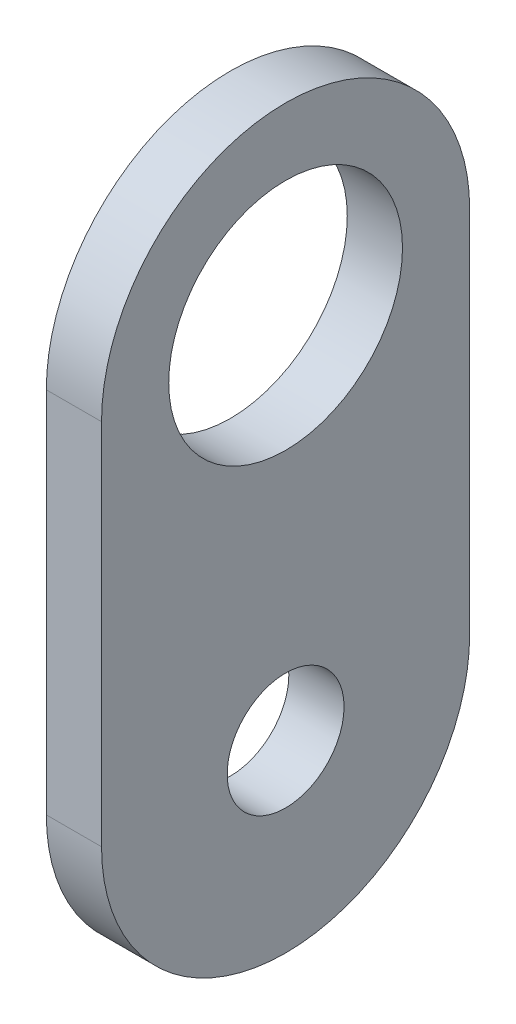
from build123d import *

# Parameters (mm, degrees)
SKETCH3_W           = 20
SKETCH3_H           = 40
BOSS_EXTRUDE1_DEPTH = 3
SKETCH4_R           = 6.35
SKETCH4_R_2         = 3.175
CUT_EXTRUDE1_DEPTH  = 5
FILLET2_RADIUS      = 10
FILLET2_LENGTH      = 3
FILLET3_RADIUS      = 10
FILLET3_LENGTH      = 3


with BuildPart() as part:
    # Sketch3 → Boss-Extrude1 (new body)
    with BuildSketch(Plane(origin=(0, 0, 0), x_dir=(0, 0, -1), z_dir=(1, 0, 0))):
        Rectangle(SKETCH3_W, SKETCH3_H)
    extrude(amount=BOSS_EXTRUDE1_DEPTH)

    # Sketch4 → Cut-Extrude1 (cut)
    with BuildSketch(Plane(origin=(3, 0, 0), x_dir=(0, 0, -1), z_dir=(1, 0, 0))):
        with Locations((0, 10)):
            Circle(SKETCH4_R)
        with Locations((0, -10)):
            Circle(SKETCH4_R_2)
    extrude(amount=-CUT_EXTRUDE1_DEPTH, mode=Mode.SUBTRACT)

    # Fillet2: full round fillet: the end face becomes a half cylinder, R = half its width
    fillet2_face = Plane((1.5, -20, 0), x_dir=(-1, 0, 0), z_dir=(0, -1, 0))  # on the end face: x along it, z out of the body
    fillet2_slab = fillet2_face.offset(-FILLET2_RADIUS / 2) * Box(FILLET2_LENGTH, 2 * FILLET2_RADIUS, FILLET2_RADIUS, mode=Mode.PRIVATE)  # the body's end, R deep
    fillet2_round = Plane((1.5, -10, 0), x_dir=(0, -1, 0), z_dir=(-1, 0, 0)) * Cylinder(FILLET2_RADIUS, FILLET2_LENGTH, mode=Mode.PRIVATE)  # its axis R under the face
    add(fillet2_slab - fillet2_round, mode=Mode.SUBTRACT)

    # Fillet3: full round fillet: the end face becomes a half cylinder, R = half its width
    fillet3_face = Plane((1.5, 20, 0), x_dir=(-1, 0, 0), z_dir=(0, 1, 0))  # on the end face: x along it, z out of the body
    fillet3_slab = fillet3_face.offset(-FILLET3_RADIUS / 2) * Box(FILLET3_LENGTH, 2 * FILLET3_RADIUS, FILLET3_RADIUS, mode=Mode.PRIVATE)  # the body's end, R deep
    fillet3_round = Plane((1.5, 10, 0), x_dir=(0, 1, 0), z_dir=(-1, 0, 0)) * Cylinder(FILLET3_RADIUS, FILLET3_LENGTH, mode=Mode.PRIVATE)  # its axis R under the face
    add(fillet3_slab - fillet3_round, mode=Mode.SUBTRACT)


solid = part.part
